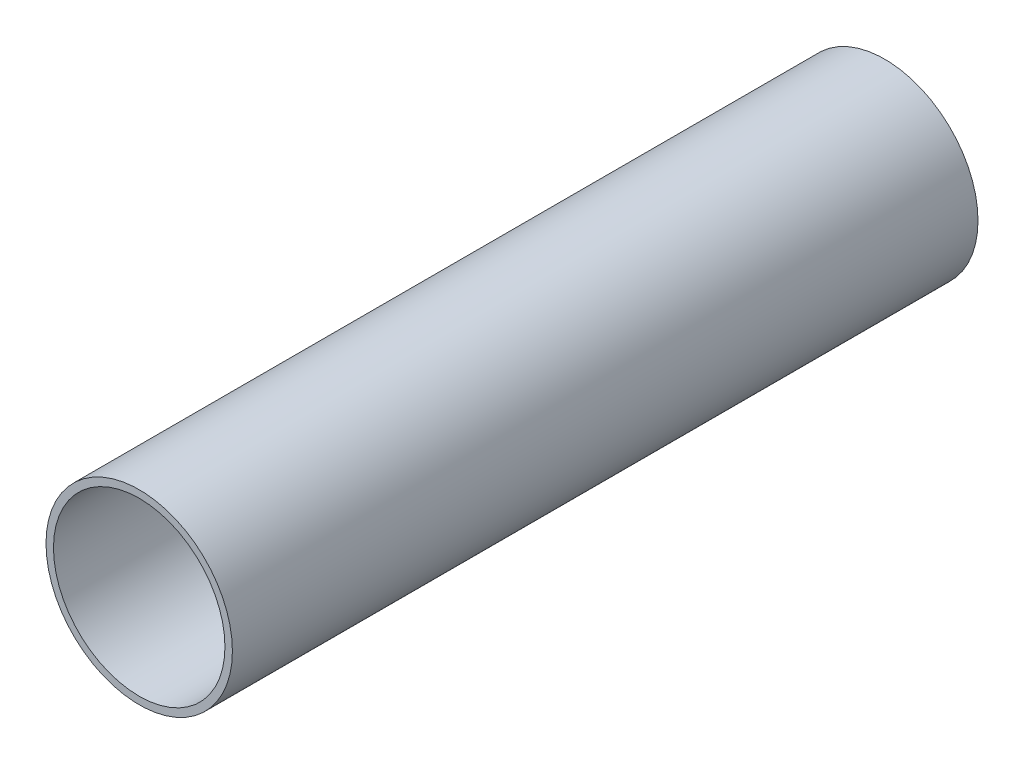
from build123d import *

# Parameters (mm, degrees)
SKETCH1_R           = 12.5
SKETCH1_R_2         = 11.5
BOSS_EXTRUDE1_DEPTH = 100


with BuildPart() as part:
    # Sketch1 → Boss-Extrude1 (new body)
    with BuildSketch(Plane.XY):
        Circle(SKETCH1_R)
        Circle(SKETCH1_R_2, mode=Mode.SUBTRACT)
    extrude(amount=BOSS_EXTRUDE1_DEPTH)


solid = part.part
